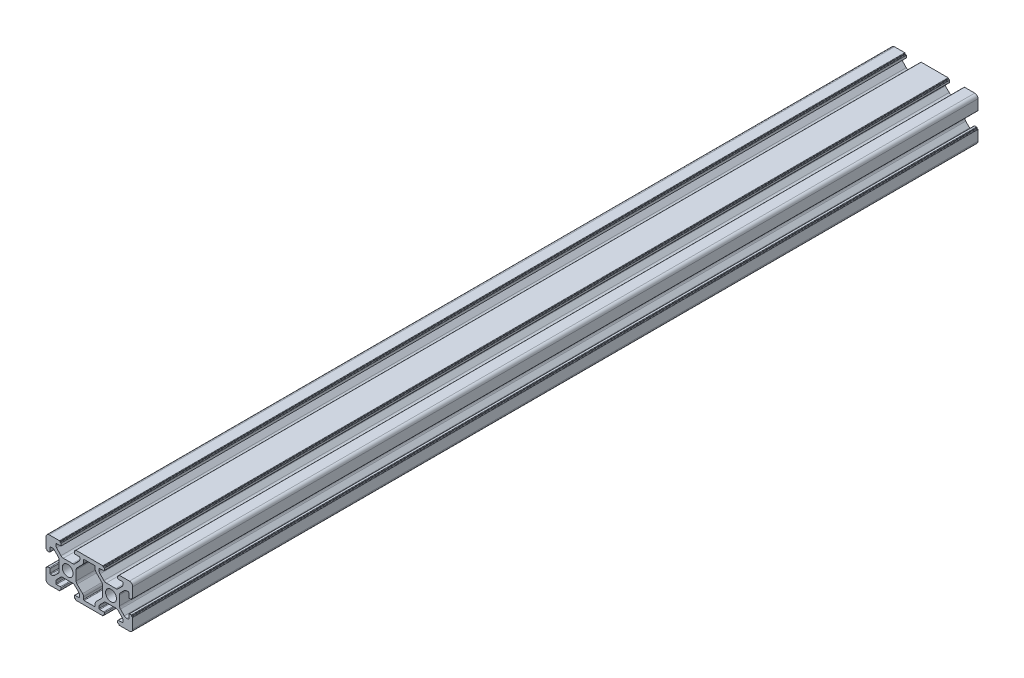
from build123d import *

# Parameters (mm, degrees)
SKETCH1_R           = 2.5
BOSS_EXTRUDE2_DEPTH = 390


with BuildPart() as part:
    # Sketch1 → Boss-Extrude2 (new body)
    with BuildSketch(Plane.XY):
        with BuildLine():
            Line((1.5, 0), (6.2, 0))
            ThreePointArc((6.2, 0), (6.341421356, 0.058578644), (6.4, 0.2))
            Line((6.4, 0.2), (6.4, 0.3))
            ThreePointArc((6.4, 0.3), (6.458578644, 0.441421356), (6.6, 0.5))
            Line((6.6, 0.5), (6.7, 0.5))
            ThreePointArc((6.7, 0.5), (6.841421356, 0.558578644), (6.9, 0.7))
            Line((6.9, 0.7), (6.9, 1.5))
            ThreePointArc((6.9, 1.5), (6.812132034, 1.712132034), (6.6, 1.8))
            Line((6.6, 1.8), (4.8, 1.8))
            ThreePointArc((4.8, 1.8), (4.587867966, 1.887867966), (4.5, 2.1))
            Line((4.5, 2.1), (4.5, 2.818019485))
            ThreePointArc((4.5, 2.818019485), (4.614180701, 3.392044633), (4.939339828, 3.878679656))
            Line((4.939339828, 3.878679656), (6.721320344, 5.660660172))
            ThreePointArc((6.721320344, 5.660660172), (7.207955367, 5.985819299), (7.781980515, 6.1))
            Line((7.781980515, 6.1), (12.218019485, 6.1))
            ThreePointArc((12.218019485, 6.1), (12.792044633, 5.985819299), (13.278679656, 5.660660172))
            Line((13.278679656, 5.660660172), (15.060660172, 3.878679656))
            ThreePointArc((15.060660172, 3.878679656), (15.385819299, 3.392044633), (15.5, 2.818019485))
            Line((15.5, 2.818019485), (15.5, 2.1))
            ThreePointArc((15.5, 2.1), (15.412132034, 1.887867966), (15.2, 1.8))
            Line((15.2, 1.8), (13.4, 1.8))
            ThreePointArc((13.4, 1.8), (13.187867966, 1.712132034), (13.1, 1.5))
            Line((13.1, 1.5), (13.1, 0.7))
            ThreePointArc((13.1, 0.7), (13.158578644, 0.558578644), (13.3, 0.5))
            Line((13.3, 0.5), (13.4, 0.5))
            ThreePointArc((13.4, 0.5), (13.541421356, 0.441421356), (13.6, 0.3))
            Line((13.6, 0.3), (13.6, 0.2))
            ThreePointArc((13.6, 0.2), (13.658578644, 0.058578644), (13.8, 0))
            Line((13.8, 0), (26.2, 0))
            ThreePointArc((26.2, 0), (26.341421356, 0.058578644), (26.4, 0.2))
            Line((26.4, 0.2), (26.4, 0.3))
            ThreePointArc((26.4, 0.3), (26.458578644, 0.441421356), (26.6, 0.5))
            Line((26.6, 0.5), (26.7, 0.5))
            ThreePointArc((26.7, 0.5), (26.841421356, 0.558578644), (26.9, 0.7))
            Line((26.9, 0.7), (26.9, 1.5))
            ThreePointArc((26.9, 1.5), (26.812132034, 1.712132034), (26.6, 1.8))
            Line((26.6, 1.8), (24.8, 1.8))
            ThreePointArc((24.8, 1.8), (24.587867966, 1.887867966), (24.5, 2.1))
            Line((24.5, 2.1), (24.5, 2.818019485))
            ThreePointArc((24.5, 2.818019485), (24.614180701, 3.392044633), (24.939339828, 3.878679656))
            Line((24.939339828, 3.878679656), (26.721320344, 5.660660172))
            ThreePointArc((26.721320344, 5.660660172), (27.207955367, 5.985819299), (27.781980515, 6.1))
            Line((27.781980515, 6.1), (32.218019485, 6.1))
            ThreePointArc((32.218019485, 6.1), (32.792044633, 5.985819299), (33.278679656, 5.660660172))
            Line((33.278679656, 5.660660172), (35.060660172, 3.878679656))
            ThreePointArc((35.060660172, 3.878679656), (35.385819299, 3.392044633), (35.5, 2.818019485))
            Line((35.5, 2.818019485), (35.5, 2.1))
            ThreePointArc((35.5, 2.1), (35.412132034, 1.887867966), (35.2, 1.8))
            Line((35.2, 1.8), (33.4, 1.8))
            ThreePointArc((33.4, 1.8), (33.187867966, 1.712132034), (33.1, 1.5))
            Line((33.1, 1.5), (33.1, 0.7))
            ThreePointArc((33.1, 0.7), (33.158578644, 0.558578644), (33.3, 0.5))
            Line((33.3, 0.5), (33.4, 0.5))
            ThreePointArc((33.4, 0.5), (33.541421356, 0.441421356), (33.6, 0.3))
            Line((33.6, 0.3), (33.6, 0.2))
            ThreePointArc((33.6, 0.2), (33.658578644, 0.058578644), (33.8, 0))
            Line((33.8, 0), (38.5, 0))
            ThreePointArc((38.5, 0), (39.560660172, 0.439339828), (40, 1.5))
            Line((40, 1.5), (40, 6.2))
            ThreePointArc((40, 6.2), (39.941421356, 6.341421356), (39.8, 6.4))
            Line((39.8, 6.4), (39.7, 6.4))
            ThreePointArc((39.7, 6.4), (39.558578644, 6.458578644), (39.5, 6.6))
            Line((39.5, 6.6), (39.5, 6.7))
            ThreePointArc((39.5, 6.7), (39.441421356, 6.841421356), (39.3, 6.9))
            Line((39.3, 6.9), (38.5, 6.9))
            ThreePointArc((38.5, 6.9), (38.287867966, 6.812132034), (38.2, 6.6))
            Line((38.2, 6.6), (38.2, 4.8))
            ThreePointArc((38.2, 4.8), (38.112132034, 4.587867966), (37.9, 4.5))
            Line((37.9, 4.5), (37.181980515, 4.5))
            ThreePointArc((37.181980515, 4.5), (36.607955367, 4.614180701), (36.121320344, 4.939339828))
            Line((36.121320344, 4.939339828), (34.339339828, 6.721320344))
            ThreePointArc((34.339339828, 6.721320344), (34.014180701, 7.207955367), (33.9, 7.781980515))
            Line((33.9, 7.781980515), (33.9, 12.218019485))
            ThreePointArc((33.9, 12.218019485), (34.014180701, 12.792044633), (34.339339828, 13.278679656))
            Line((34.339339828, 13.278679656), (36.121320344, 15.060660172))
            ThreePointArc((36.121320344, 15.060660172), (36.607955367, 15.385819299), (37.181980515, 15.5))
            Line((37.181980515, 15.5), (37.9, 15.5))
            ThreePointArc((37.9, 15.5), (38.112132034, 15.412132034), (38.2, 15.2))
            Line((38.2, 15.2), (38.2, 13.4))
            ThreePointArc((38.2, 13.4), (38.287867966, 13.187867966), (38.5, 13.1))
            Line((38.5, 13.1), (39.3, 13.1))
            ThreePointArc((39.3, 13.1), (39.441421356, 13.158578644), (39.5, 13.3))
            Line((39.5, 13.3), (39.5, 13.4))
            ThreePointArc((39.5, 13.4), (39.558578644, 13.541421356), (39.7, 13.6))
            Line((39.7, 13.6), (39.8, 13.6))
            ThreePointArc((39.8, 13.6), (39.941421356, 13.658578644), (40, 13.8))
            Line((40, 13.8), (40, 18.5))
            ThreePointArc((40, 18.5), (39.560660172, 19.560660172), (38.5, 20))
            Line((38.5, 20), (33.8, 20))
            ThreePointArc((33.8, 20), (33.658578644, 19.941421356), (33.6, 19.8))
            Line((33.6, 19.8), (33.6, 19.7))
            ThreePointArc((33.6, 19.7), (33.541421356, 19.558578644), (33.4, 19.5))
            Line((33.4, 19.5), (33.3, 19.5))
            ThreePointArc((33.3, 19.5), (33.158578644, 19.441421356), (33.1, 19.3))
            Line((33.1, 19.3), (33.1, 18.5))
            ThreePointArc((33.1, 18.5), (33.187867966, 18.287867966), (33.4, 18.2))
            Line((33.4, 18.2), (35.2, 18.2))
            ThreePointArc((35.2, 18.2), (35.412132034, 18.112132034), (35.5, 17.9))
            Line((35.5, 17.9), (35.5, 17.181980515))
            ThreePointArc((35.5, 17.181980515), (35.385819299, 16.607955367), (35.060660172, 16.121320344))
            Line((35.060660172, 16.121320344), (33.278679656, 14.339339828))
            ThreePointArc((33.278679656, 14.339339828), (32.792044633, 14.014180701), (32.218019485, 13.9))
            Line((32.218019485, 13.9), (27.781980515, 13.9))
            ThreePointArc((27.781980515, 13.9), (27.207955367, 14.014180701), (26.721320344, 14.339339828))
            Line((26.721320344, 14.339339828), (24.939339828, 16.121320344))
            ThreePointArc((24.939339828, 16.121320344), (24.614180701, 16.607955367), (24.5, 17.181980515))
            Line((24.5, 17.181980515), (24.5, 17.9))
            ThreePointArc((24.5, 17.9), (24.587867966, 18.112132034), (24.8, 18.2))
            Line((24.8, 18.2), (26.6, 18.2))
            ThreePointArc((26.6, 18.2), (26.812132034, 18.287867966), (26.9, 18.5))
            Line((26.9, 18.5), (26.9, 19.3))
            ThreePointArc((26.9, 19.3), (26.841421356, 19.441421356), (26.7, 19.5))
            Line((26.7, 19.5), (26.6, 19.5))
            ThreePointArc((26.6, 19.5), (26.458578644, 19.558578644), (26.4, 19.7))
            Line((26.4, 19.7), (26.4, 19.8))
            ThreePointArc((26.4, 19.8), (26.341421356, 19.941421356), (26.2, 20))
            Line((26.2, 20), (13.8, 20))
            ThreePointArc((13.8, 20), (13.658578644, 19.941421356), (13.6, 19.8))
            Line((13.6, 19.8), (13.6, 19.7))
            ThreePointArc((13.6, 19.7), (13.541421356, 19.558578644), (13.4, 19.5))
            Line((13.4, 19.5), (13.3, 19.5))
            ThreePointArc((13.3, 19.5), (13.158578644, 19.441421356), (13.1, 19.3))
            Line((13.1, 19.3), (13.1, 18.2))
            Line((13.1, 18.2), (15.3, 18.2))
            ThreePointArc((15.3, 18.2), (15.512132034, 18.112132034), (15.6, 17.9))
            Line((15.6, 17.9), (15.6, 17.281980515))
            ThreePointArc((15.6, 17.281980515), (15.485819299, 16.707955367), (15.160660172, 16.221320344))
            Line((15.160660172, 16.221320344), (13.278679656, 14.339339828))
            ThreePointArc((13.278679656, 14.339339828), (12.792044633, 14.014180701), (12.218019485, 13.9))
            Line((12.218019485, 13.9), (7.986375635, 13.9))
            ThreePointArc((7.986375635, 13.9), (7.393381044, 14.022191082), (6.896997987, 14.36885678))
            Line((6.896997987, 14.36885678), (4.910622352, 16.467414163))
            ThreePointArc((4.910622352, 16.467414163), (4.606431474, 16.943609851), (4.5, 17.498557383))
            Line((4.5, 17.498557383), (4.5, 17.9))
            ThreePointArc((4.5, 17.9), (4.587867966, 18.112132034), (4.8, 18.2))
            Line((4.8, 18.2), (6.9, 18.2))
            Line((6.9, 18.2), (6.9, 19.3))
            ThreePointArc((6.9, 19.3), (6.841421356, 19.441421356), (6.7, 19.5))
            Line((6.7, 19.5), (6.6, 19.5))
            ThreePointArc((6.6, 19.5), (6.458578644, 19.558578644), (6.4, 19.7))
            Line((6.4, 19.7), (6.4, 19.8))
            ThreePointArc((6.4, 19.8), (6.341421356, 19.941421356), (6.2, 20))
            Line((6.2, 20), (1.5, 20))
            ThreePointArc((1.5, 20), (0.439339828, 19.560660172), (0, 18.5))
            Line((0, 18.5), (0, 13.8))
            ThreePointArc((0, 13.8), (0.058578644, 13.658578644), (0.2, 13.6))
            Line((0.2, 13.6), (0.3, 13.6))
            ThreePointArc((0.3, 13.6), (0.441421356, 13.541421356), (0.5, 13.4))
            Line((0.5, 13.4), (0.5, 13.3))
            ThreePointArc((0.5, 13.3), (0.558578644, 13.158578644), (0.7, 13.1))
            Line((0.7, 13.1), (1.5, 13.1))
            ThreePointArc((1.5, 13.1), (1.712132034, 13.187867966), (1.8, 13.4))
            Line((1.8, 13.4), (1.8, 15.2))
            ThreePointArc((1.8, 15.2), (1.887867966, 15.412132034), (2.1, 15.5))
            Line((2.1, 15.5), (2.818019485, 15.5))
            ThreePointArc((2.818019485, 15.5), (3.392044633, 15.385819299), (3.878679656, 15.060660172))
            Line((3.878679656, 15.060660172), (5.660660172, 13.278679656))
            ThreePointArc((5.660660172, 13.278679656), (5.985819299, 12.792044633), (6.1, 12.218019485))
            Line((6.1, 12.218019485), (6.1, 7.781980515))
            ThreePointArc((6.1, 7.781980515), (5.985819299, 7.207955367), (5.660660172, 6.721320344))
            Line((5.660660172, 6.721320344), (3.878679656, 4.939339828))
            ThreePointArc((3.878679656, 4.939339828), (3.392044633, 4.614180701), (2.818019485, 4.5))
            Line((2.818019485, 4.5), (2.1, 4.5))
            ThreePointArc((2.1, 4.5), (1.887867966, 4.587867966), (1.8, 4.8))
            Line((1.8, 4.8), (1.8, 6.6))
            ThreePointArc((1.8, 6.6), (1.712132034, 6.812132034), (1.5, 6.9))
            Line((1.5, 6.9), (0.7, 6.9))
            ThreePointArc((0.7, 6.9), (0.558578644, 6.841421356), (0.5, 6.7))
            Line((0.5, 6.7), (0.5, 6.6))
            ThreePointArc((0.5, 6.6), (0.441421356, 6.458578644), (0.3, 6.4))
            Line((0.3, 6.4), (0.2, 6.4))
            ThreePointArc((0.2, 6.4), (0.058578644, 6.341421356), (0, 6.2))
            Line((0, 6.2), (0, 1.5))
            ThreePointArc((0, 1.5), (0.439339828, 0.439339828), (1.5, 0))
        make_face()
        with Locations((10, 10)):
            Circle(SKETCH1_R, mode=Mode.SUBTRACT)
        with Locations((30, 10)):
            Circle(SKETCH1_R, mode=Mode.SUBTRACT)
        with BuildLine():
            Line((17.6, 1.8), (22.4, 1.8))
            ThreePointArc((22.4, 1.8), (22.612132034, 1.887867966), (22.7, 2.1))
            Line((22.7, 2.1), (22.7, 3.139339828))
            ThreePointArc((22.7, 3.139339828), (22.814180701, 3.713364977), (23.139339828, 4.2))
            Line((23.139339828, 4.2), (25.660660172, 6.721320344))
            ThreePointArc((25.660660172, 6.721320344), (25.985819299, 7.207955367), (26.1, 7.781980515))
            Line((26.1, 7.781980515), (26.1, 12.218019485))
            ThreePointArc((26.1, 12.218019485), (25.985819299, 12.792044633), (25.660660172, 13.278679656))
            Line((25.660660172, 13.278679656), (23.139339828, 15.8))
            ThreePointArc((23.139339828, 15.8), (22.814180701, 16.286635023), (22.7, 16.860660172))
            Line((22.7, 16.860660172), (22.7, 17.9))
            ThreePointArc((22.7, 17.9), (22.612132034, 18.112132034), (22.4, 18.2))
            Line((22.4, 18.2), (17.6, 18.2))
            ThreePointArc((17.6, 18.2), (17.387867966, 18.112132034), (17.3, 17.9))
            Line((17.3, 17.9), (17.3, 16.860660172))
            ThreePointArc((17.3, 16.860660172), (17.185819299, 16.286635023), (16.860660172, 15.8))
            Line((16.860660172, 15.8), (14.339339828, 13.278679656))
            ThreePointArc((14.339339828, 13.278679656), (14.014180701, 12.792044633), (13.9, 12.218019485))
            Line((13.9, 12.218019485), (13.9, 7.781980515))
            ThreePointArc((13.9, 7.781980515), (14.014180701, 7.207955367), (14.339339828, 6.721320344))
            Line((14.339339828, 6.721320344), (16.860660172, 4.2))
            ThreePointArc((16.860660172, 4.2), (17.185819299, 3.713364977), (17.3, 3.139339828))
            Line((17.3, 3.139339828), (17.3, 2.1))
            ThreePointArc((17.3, 2.1), (17.387867966, 1.887867966), (17.6, 1.8))
        make_face(mode=Mode.SUBTRACT)
    extrude(amount=BOSS_EXTRUDE2_DEPTH)


solid = part.part
